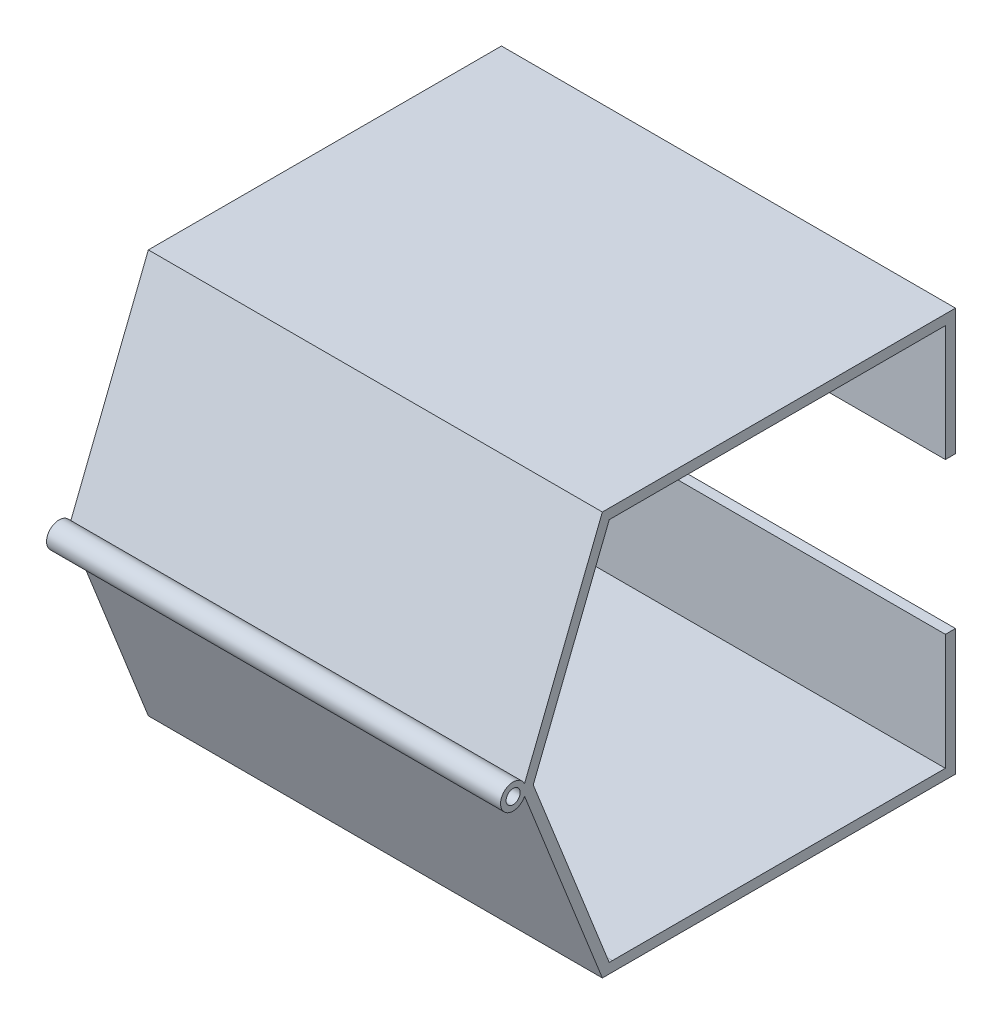
from build123d import *

# Parameters (mm, degrees)
SKETCH1_W           = 90
SKETCH1_H           = 80
BOSS_EXTRUDE4_DEPTH = 70
BOSS_EXTRUDE5_DEPTH = 90
SKETCH9_R           = 2.5
SKETCH9_R_2         = 1.4
BOSS_EXTRUDE6_DEPTH = 90
SKETCH10_W          = 66
SKETCH10_H          = 76
CUT_EXTRUDE1_DEPTH  = 134.541756472
CUT_EXTRUDE2_DEPTH  = 134.541756472
SKETCH16_W          = 90
SKETCH16_H          = 30
CUT_EXTRUDE3_DEPTH  = 10


with BuildPart() as part:
    # Sketch1 → Boss-Extrude4 (new body)
    with BuildSketch(Plane.XY):
        Rectangle(SKETCH1_W, SKETCH1_H)
    extrude(amount=BOSS_EXTRUDE4_DEPTH)

    # Sketch8 → Boss-Extrude5 (add, through all)
    with BuildSketch(Plane.ZY.offset(45)):
        Polygon((70, 40), (85.852498999, 0), (70, -40), align=None)
    extrude(amount=-BOSS_EXTRUDE5_DEPTH)

    # Sketch9 → Boss-Extrude6 (add, through all)
    with BuildSketch(Plane.ZY.offset(45)):
        with Locations((87.685368667, 0)):
            Circle(SKETCH9_R)
        with Locations(Location((87.685368667, 0, 0), (0, 0, 270))):
            Circle(SKETCH9_R_2, mode=Mode.SUBTRACT)
    extrude(amount=-BOSS_EXTRUDE6_DEPTH)

    # Sketch10 → Cut-Extrude1 (cut, through all)
    with BuildSketch(Plane.ZY.offset(45)):
        with Locations((35, 0)):
            Rectangle(SKETCH10_W, SKETCH10_H)
    extrude(amount=-CUT_EXTRUDE1_DEPTH, mode=Mode.SUBTRACT)

    # Sketch11 → Cut-Extrude2 (cut, through all)
    with BuildSketch(Plane(origin=(45, 0, 0), x_dir=(0, 0, -1), z_dir=(1, 0, 0))):
        Polygon((-68.641168629, 38.000299069), (-83.701161204, 0), (-68.640413999, -38.002203199), (-68, -38), (-68, 38), align=None)
    extrude(amount=-CUT_EXTRUDE2_DEPTH, mode=Mode.SUBTRACT)

    # Sketch16 → Cut-Extrude3 (cut)
    with BuildSketch(Plane(origin=(0, 0, 0), x_dir=(-1, 0, 0), z_dir=(0, 0, -1))):
        Rectangle(SKETCH16_W, SKETCH16_H)
    extrude(amount=-CUT_EXTRUDE3_DEPTH, mode=Mode.SUBTRACT)


solid = part.part
